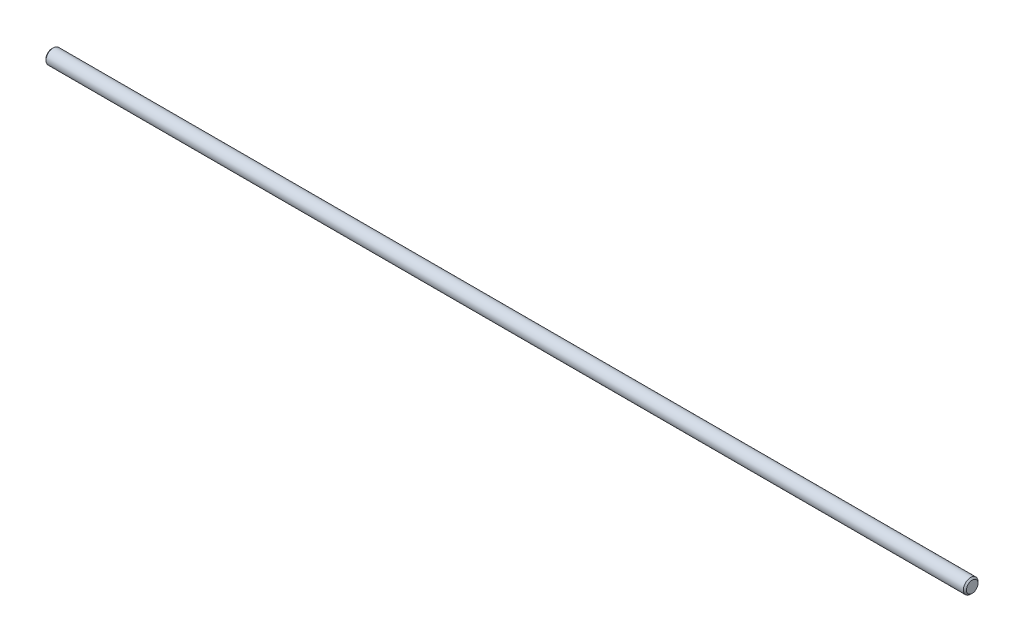
from build123d import *

# Parameters (mm, degrees)
SKETCH1_R           = 4.7625
BOSS_EXTRUDE1_DEPTH = 300
CHAMFER1_SIZE       = 1


with BuildPart() as part:
    # Sketch1 → Boss-Extrude1 (new, symmetric)
    with BuildSketch(Plane(origin=(0, 0, 0), x_dir=(0, 0, -1), z_dir=(1, 0, 0))):
        Circle(SKETCH1_R)
    extrude(amount=BOSS_EXTRUDE1_DEPTH, both=True)

    # Chamfer1
    chamfer1_edges = [part.edges().sort_by_distance(p)[0] for p in [
        (-300, 0, 4.7625),
        (300, 0, 4.7625),
    ]]
    chamfer(chamfer1_edges, length=CHAMFER1_SIZE)


solid = part.part
